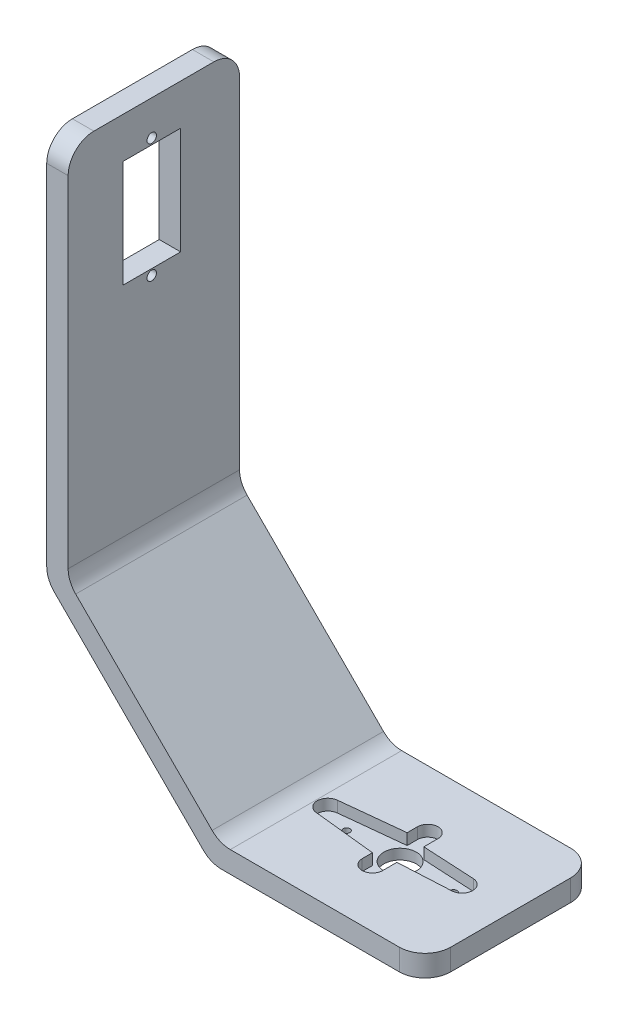
from build123d import *

# Parameters (mm, degrees)
EXTRUDE_1_DEPTH     = 40
FILLET_7_R          = 6
CUT_EXTRUDE_4_DEPTH = 2.6
SKETCH_7_R          = 1.1
SKETCH_7_W          = 13.5
SKETCH_7_H          = 25
CUT_EXTRUDE_5_DEPTH = 10
FILLET_8_R          = 6
FILLET_9_R          = 6
FILLET_10_R         = 6
FILLET_11_R         = 6
FILLET_12_R         = 6
FILLET_13_R         = 6
FILLET_14_R         = 6
SKETCH_10_R         = 3.8
SKETCH_10_R_2       = 0.8
CUT_EXTRUDE_7_DEPTH = 10


with BuildPart() as part:
    # 草图1 → 凸台-拉伸1 (new body)
    with BuildSketch(Plane.XY):
        Polygon((15.872975722, -72.274332462), (-32.055956466, -72.274332462), (-67.411295525, -36.918993403), (-67.411295525, 51.009938785), (-72.411295525, 51.009938785), (-72.411295525, -38.990061215), (-34.127024278, -77.274332462), (15.872975722, -77.274332462), align=None)
    extrude(amount=EXTRUDE_1_DEPTH)

    # 圆角7
    fillet_7_edges = [part.edges().sort_by_distance(p)[0] for p in [
        (-34.127024278, -77.274332462, 20),
    ]]
    fillet(fillet_7_edges, radius=FILLET_7_R)

    # 草图6 → 切除-拉伸4 (cut)
    with BuildSketch(Plane(origin=(0, -72.274332462, 0), x_dir=(1, 0, 0), z_dir=(0, 1, 0))):
        with BuildLine():
            Line((4.635801051, -17.503483429), (-7.546126997, -16.859731248))
            Line((-7.546126997, -16.859731248), (-7.546126997, -13.55))
            ThreePointArc((-7.546126997, -13.55), (-9.946126997, -11.15), (-12.346126997, -13.55))
            Line((-12.346126997, -13.55), (-12.346126997, -15.950319654))
            Line((-12.346126997, -15.950319654), (-27.060314717, -17.51399822))
            ThreePointArc((-27.060314717, -17.51399822), (-29.296126997, -20), (-27.060314717, -22.48600178))
            Line((-27.060314717, -22.48600178), (-12.346126997, -24.049680346))
            Line((-12.346126997, -24.049680346), (-12.346126997, -26.45))
            ThreePointArc((-12.346126997, -26.45), (-9.946126997, -28.85), (-7.546126997, -26.45))
            Line((-7.546126997, -26.45), (-7.546126997, -23.140268752))
            Line((-7.546126997, -23.140268752), (4.635801051, -22.496516571))
            ThreePointArc((4.635801051, -22.496516571), (7.003873003, -20), (4.635801051, -17.503483429))
        make_face()
    extrude(amount=-CUT_EXTRUDE_4_DEPTH, mode=Mode.SUBTRACT)

    # 草图7 → 切除-拉伸5 (cut)
    with BuildSketch(Plane(origin=(-67.411295525, -6.360766816, 0), x_dir=(0, 0, -1), z_dir=(-1, 0, 0))):
        with Locations((-20.5, -49.239005853)):
            Circle(SKETCH_7_R)
        with Locations((-20.5, -21.439005853)):
            Circle(SKETCH_7_R)
        with Locations((-20.5, -35.339005853)):
            Rectangle(SKETCH_7_W, SKETCH_7_H)
    extrude(amount=CUT_EXTRUDE_5_DEPTH, mode=Mode.SUBTRACT)

    # 圆角8
    fillet_8_edges = [part.edges().sort_by_distance(p)[0] for p in [
        (-32.055956466, -72.274332462, 20),
    ]]
    fillet(fillet_8_edges, radius=FILLET_8_R)

    # 圆角9
    fillet_9_edges = [part.edges().sort_by_distance(p)[0] for p in [
        (-72.411295525, -38.990061215, 20),
    ]]
    fillet(fillet_9_edges, radius=FILLET_9_R)

    # 圆角10
    fillet_10_edges = [part.edges().sort_by_distance(p)[0] for p in [
        (-67.411295525, -36.918993403, 20),
    ]]
    fillet(fillet_10_edges, radius=FILLET_10_R)

    # 圆角11
    fillet_11_edges = [part.edges().sort_by_distance(p)[0] for p in [
        (-69.911295525, 51.009938785, 0),
    ]]
    fillet(fillet_11_edges, radius=FILLET_11_R)

    # 圆角12
    fillet_12_edges = [part.edges().sort_by_distance(p)[0] for p in [
        (-69.911295525, 51.009938785, 40),
    ]]
    fillet(fillet_12_edges, radius=FILLET_12_R)

    # 圆角13
    fillet_13_edges = [part.edges().sort_by_distance(p)[0] for p in [
        (15.872975722, -74.774332462, 0),
    ]]
    fillet(fillet_13_edges, radius=FILLET_13_R)

    # 圆角14
    fillet_14_edges = [part.edges().sort_by_distance(p)[0] for p in [
        (15.872975722, -74.774332462, 40),
    ]]
    fillet(fillet_14_edges, radius=FILLET_14_R)

    # 草图10 → 切除-拉伸7 (cut)
    with BuildSketch(Plane(origin=(0, -74.874332462, 0), x_dir=(1, 0, 0), z_dir=(0, 1, 0))):
        with Locations(Location((-9.946126997, -20, 0), (0, 0, 180))):
            Circle(SKETCH_10_R)
        with Locations(Location((2.553873003, -20, 0), (0, 0, 180))):
            Circle(SKETCH_10_R_2)
        with Locations(Location((-22.446126997, -20, 0), (0, 0, 270))):
            Circle(SKETCH_10_R_2)
    extrude(amount=-CUT_EXTRUDE_7_DEPTH, mode=Mode.SUBTRACT)


solid = part.part
